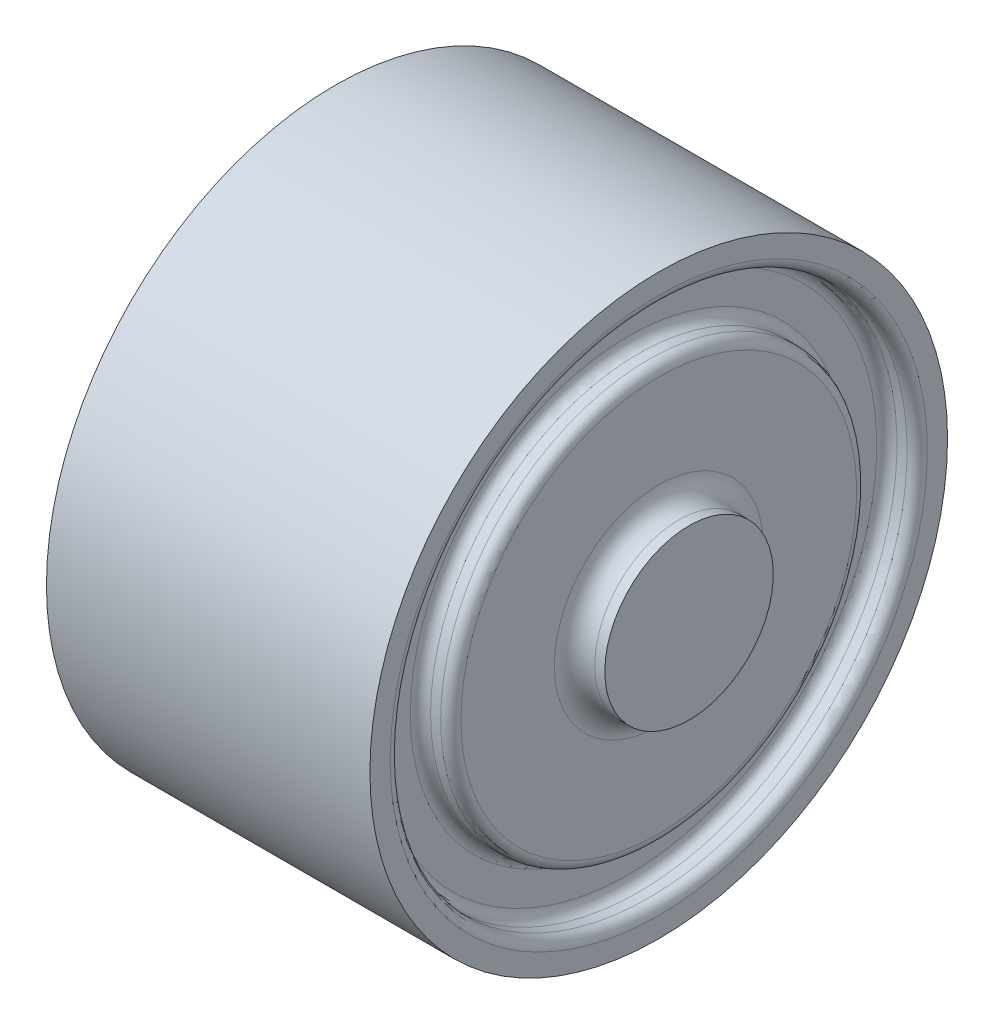
from build123d import *


with BuildPart() as part:
    # 草图1 → 旋转1 (revolve)
    with BuildSketch(Plane.XY, mode=Mode.PRIVATE) as revolve_1_sk:
        with BuildLine():
            Line((-19, 0), (-19, 8.333333333))
            Line((-19, 8.333333333), (-18, 8.333333333))
            ThreePointArc((-18, 8.333333333), (-16.585786438, 8.919119771), (-16, 10.333333333))
            Line((-16, 10.333333333), (-16, 19.571428571))
            ThreePointArc((-16, 19.571428571), (-15.707106781, 20.278535353), (-15, 20.571428571))
            Line((-15, 20.571428571), (-14, 20.571428571))
            ThreePointArc((-14, 20.571428571), (-13.292893219, 20.86432179), (-13, 21.571428571))
            Line((-13, 21.571428571), (-13, 24.571428571))
            ThreePointArc((-13, 24.571428571), (-13.292893219, 25.278535353), (-14, 25.571428571))
            Line((-14, 25.571428571), (-15, 25.571428571))
            ThreePointArc((-15, 25.571428571), (-15.707106781, 25.86432179), (-16, 26.571428571))
            Line((-16, 26.571428571), (-16, 28.571428571))
            Line((-16, 28.571428571), (16, 28.571428571))
            Line((16, 28.571428571), (16, 26.571428571))
            ThreePointArc((16, 26.571428571), (15.707106781, 25.86432179), (15, 25.571428571))
            Line((15, 25.571428571), (14, 25.571428571))
            ThreePointArc((14, 25.571428571), (13.292893219, 25.278535353), (13, 24.571428571))
            Line((13, 24.571428571), (13, 21.571428571))
            ThreePointArc((13, 21.571428571), (13.292893219, 20.86432179), (14, 20.571428571))
            Line((14, 20.571428571), (15, 20.571428571))
            ThreePointArc((15, 20.571428571), (15.707106781, 20.278535353), (16, 19.571428571))
            Line((16, 19.571428571), (16, 10.333333333))
            ThreePointArc((16, 10.333333333), (16.585786438, 8.919119771), (18, 8.333333333))
            Line((18, 8.333333333), (19, 8.333333333))
            Line((19, 8.333333333), (19, 0))
            Line((19, 0), (-19, 0))
        make_face()
    revolve(revolve_1_sk.sketch.rotate(Axis((19, 0, 0), (-1, 0, 0)), 270), axis=Axis((19, 0, 0), (-1, 0, 0)))


solid = part.part
